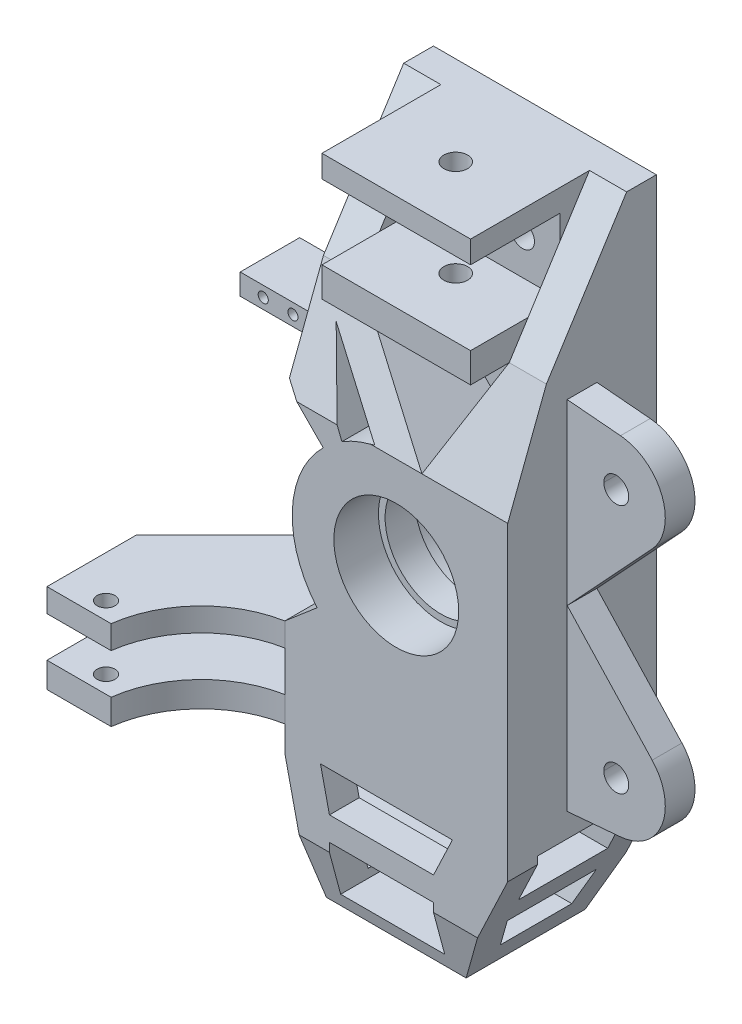
from build123d import *

# Parameters (mm, degrees)
SKETCH1_W                         = 75
SKETCH1_H                         = 50
BE_MAIN_UPRIGHT_BODY_DEPTH        = 221
SKETCH4_R                         = 18.75
CE_THROUGH_HOLE_DEPTH             = 230.667694724
SKETCH2_R                         = 21
CE_INNER_BEARING_DEPTH            = 15
SKETCH3_R                         = 23.5
CE_OUTER_BEARING_DEPTH            = 15
SKETCH7_W                         = 10
SKETCH7_H                         = 120
BE_CALIPER_MOUNT_DEPTH            = 33
SKETCH21_W                        = 30
SKETCH21_H                        = 7.080920813
BE_TEMP_SENSOR_MOUNT_V2_DEPTH     = 10
SKETCH9_W                         = 60
SKETCH9_H                         = 30
BE_TIE_ROD_MOUNT_DEPTH            = 50
SKETCH10_R                        = 4.2
CE_CALIPER_HOLES_DEPTH            = 243.893495178
SKETCH12_R                        = 4
CE_TOP_CLEVIS_HOLES_DEPTH         = 243.893495178
SKETCH33_W                        = 50
SKETCH33_H                        = 25
CE_SIMPLE_TOP_CLEVIS_SPACE_DEPTH  = 30
SKETCH34_R                        = 4
CUT_EXTRUDE12_DEPTH               = 42.5
SKETCH14_W                        = 25
SKETCH14_H                        = 12
CE_BOTTOM_CLEVIS_SPACE_DEPTH      = 243.893495178
SKETCH15_W                        = 25
SKETCH15_H                        = 5
CE_EXPAND_BOTTOM_CLEVIS_DEPTH     = 243.893495178
CE_WIDEN_BOTTOM_CLEVIS_DEPTH      = 240.74121548
CE_WIDEN_BOTTOM_CLEVIS_DEPTH_BACK = 240.74121548
SKETCH16_W                        = 10.007554032
SKETCH16_H                        = 17
CHAMFER1_SIZE                     = 30
SKETCH18_W                        = 14.04398123
SKETCH18_H                        = 13.562779604
CUT_EXTRUDE1_DEPTH                = 20
SKETCH19_R                        = 3
CUT_EXTRUDE2_DEPTH                = 177.032667423
SKETCH22_R                        = 1.7
CUT_EXTRUDE4_DEPTH                = 20
SKETCH31_R                        = 4
CUT_EXTRUDE9_DEPTH                = 31.5
SKETCH35_R                        = 21
CUT_EXTRUDE13_DEPTH               = 10
CUT_EXTRUDE14_REACH               = 244.893
CUT_EXTRUDE15_REACH               = 244.893
SKETCH38_W                        = 50
SKETCH38_H                        = 13.562779604
CUT_EXTRUDE16_DEPTH               = 251.793241536
CUT_EXTRUDE17_DEPTH               = 177.032667423
CUT_EXTRUDE18_DEPTH               = 30
CUT_EXTRUDE19_DEPTH               = 30
CUT_EXTRUDE20_REACH               = 244.893
CUT_EXTRUDE21_REACH               = 245.972
CUT_EXTRUDE21_DIRECTION_2_REACH   = 245.972
CUT_EXTRUDE22_REACH               = 245.972
CUT_EXTRUDE22_DIRECTION_2_REACH   = 245.972
CUT_EXTRUDE28_REACH               = 261.79
CUT_EXTRUDE31_START               = -25
CUT_EXTRUDE31_DEPTH               = 12.5
CUT_EXTRUDE32_START               = 25
CUT_EXTRUDE32_DEPTH               = 12.5
CUT_EXTRUDE33_START               = -37.5
SKETCH53_W                        = 30
SKETCH53_H                        = 15.915336889
CUT_EXTRUDE33_DEPTH               = 75
CUT_EXTRUDE34_REACH               = 244.893


with BuildPart() as part:
    # Sketch1 → BE - main upright body (new body)
    with BuildSketch(Plane(origin=(0, 0, 0), x_dir=(1, 0, 0), z_dir=(0, 1, 0))):
        Rectangle(SKETCH1_W, SKETCH1_H)
    extrude(amount=BE_MAIN_UPRIGHT_BODY_DEPTH)

    # Sketch4 → CE - Through hole (cut, through all)
    with BuildSketch(Plane.XY.offset(25)):
        with Locations((0, 110.5)):
            Circle(SKETCH4_R)
    extrude(amount=-CE_THROUGH_HOLE_DEPTH, mode=Mode.SUBTRACT)

    # Sketch2 → CE - Inner bearing (cut)
    with BuildSketch(Plane.XY.offset(25)):
        with Locations((0, 110.5)):
            Circle(SKETCH2_R)
    extrude(amount=-CE_INNER_BEARING_DEPTH, mode=Mode.SUBTRACT)

    # Sketch3 → CE - Outer bearing (cut)
    with BuildSketch(Plane(origin=(0, 0, -25), x_dir=(-1, 0, 0), z_dir=(0, 0, -1))):
        with Locations((0, 110.5)):
            Circle(SKETCH3_R)
    extrude(amount=-CE_OUTER_BEARING_DEPTH, mode=Mode.SUBTRACT)

    # Sketch7 → BE - caliper mount (add)
    with BuildSketch(Plane(origin=(37.5, 0, 0), x_dir=(0, 0, -1), z_dir=(1, 0, 0))):
        with Locations((0, 110.5)):
            Rectangle(SKETCH7_W, SKETCH7_H)
    extrude(amount=BE_CALIPER_MOUNT_DEPTH)

    # Sketch21 → BE - temp sensor mount v2 (add, symmetric)
    with BuildSketch(Plane.XY):
        with Locations((-52.5, 154.131183389)):
            Rectangle(SKETCH21_W, SKETCH21_H)
    extrude(amount=BE_TEMP_SENSOR_MOUNT_V2_DEPTH, both=True)

    # Sketch9 → BE - tie rod mount (add)
    with BuildSketch(Plane.ZY.offset(37.5)):
        with Locations((25, 63.5)):
            Rectangle(SKETCH9_W, SKETCH9_H)
    extrude(amount=BE_TIE_ROD_MOUNT_DEPTH)

    # Sketch10 → CE - caliper holes (cut, through all)
    with BuildSketch(Plane.XY.offset(5)):
        with Locations((54, 152.5)):
            Circle(SKETCH10_R)
        with Locations((54, 68.5)):
            Circle(SKETCH10_R)
    extrude(amount=-CE_CALIPER_HOLES_DEPTH, mode=Mode.SUBTRACT)

    # Sketch12 → CE - top clevis holes (cut, through all)
    with BuildSketch(Plane.XY.offset(25)):
        with Locations((-12.5, 201)):
            Circle(SKETCH12_R)
        with Locations((12.5, 201)):
            Circle(SKETCH12_R)
    extrude(amount=-CE_TOP_CLEVIS_HOLES_DEPTH, mode=Mode.SUBTRACT)

    # Sketch33 → CE - simple top clevis space (cut)
    with BuildSketch(Plane.XY.offset(25)):
        with Locations((0, 201)):
            Rectangle(SKETCH33_W, SKETCH33_H)
    extrude(amount=-CE_SIMPLE_TOP_CLEVIS_SPACE_DEPTH, mode=Mode.SUBTRACT)

    # Sketch34 → Cut-Extrude12 (cut)
    with BuildSketch(Plane(origin=(0, 221, 0), x_dir=(1, 0, 0), z_dir=(0, 1, 0))):
        with Locations(Location((0, -5, 0), (0, 0, 90))):
            Circle(SKETCH34_R)
    extrude(amount=-CUT_EXTRUDE12_DEPTH, mode=Mode.SUBTRACT)

    # Sketch14 → CE - bottom clevis space (cut, through all)
    with BuildSketch(Plane.XY.offset(25)):
        with Locations((-9.98, 10.5)):
            Rectangle(SKETCH14_W, SKETCH14_H)
    extrude(amount=-CE_BOTTOM_CLEVIS_SPACE_DEPTH, mode=Mode.SUBTRACT)

    # Sketch15 → CE - expand bottom clevis (cut, through all)
    with BuildSketch(Plane.XY.offset(25)):
        with Locations((-9.98, 19)):
            Rectangle(SKETCH15_W, SKETCH15_H)
    extrude(amount=-CE_EXPAND_BOTTOM_CLEVIS_DEPTH, mode=Mode.SUBTRACT)

    # Sketch16 → CE - widen bottom clevis (cut, two sides: drawn at the far end of the back side and taken through both)
    with BuildSketch(Plane(origin=(2.52, 4.5, 25), x_dir=(1, 0, 0), z_dir=(0, 0, 1)).offset(-CE_WIDEN_BOTTOM_CLEVIS_DEPTH_BACK)):
        with Locations((5.003777016, 8.5)):
            Rectangle(SKETCH16_W, SKETCH16_H)
    extrude(amount=CE_WIDEN_BOTTOM_CLEVIS_DEPTH + CE_WIDEN_BOTTOM_CLEVIS_DEPTH_BACK, mode=Mode.SUBTRACT)

    # Chamfer1
    chamfer1_edges = [part.edges().sort_by_distance(p)[0] for p in [
        (-87.5, 63.5, -5),
    ]]
    chamfer(chamfer1_edges, length=CHAMFER1_SIZE)

    # Sketch18 → Cut-Extrude1 (cut)
    with BuildSketch(Plane.XY.offset(55)):
        with Locations((-73.48, 63.84)):
            Rectangle(SKETCH18_W, SKETCH18_H)
    extrude(amount=-CUT_EXTRUDE1_DEPTH, mode=Mode.SUBTRACT)

    # Sketch19 → Cut-Extrude2 (cut, through all)
    with BuildSketch(Plane(origin=(0, 78.5, 0), x_dir=(1, 0, 0), z_dir=(0, 1, 0))):
        with Locations(Location((-73.48, -49.15, 0), (0, 0, 270))):
            Circle(SKETCH19_R)
    extrude(amount=-CUT_EXTRUDE2_DEPTH, mode=Mode.SUBTRACT)

    # Sketch22 → Cut-Extrude4 (cut)
    with BuildSketch(Plane.XY.offset(10)):
        with Locations((-59.752411208, 154.131183389)):
            Circle(SKETCH22_R)
        with Locations((-49.752411208, 154.131183389)):
            Circle(SKETCH22_R)
    extrude(amount=-CUT_EXTRUDE4_DEPTH, mode=Mode.SUBTRACT)

    # Sketch31 → Cut-Extrude9 (cut)
    with BuildSketch(Plane.XZ):
        with Locations(Location((-9.98, -1.65, 0), (0, 0, 90))):
            Circle(SKETCH31_R)
    extrude(amount=-CUT_EXTRUDE9_DEPTH, mode=Mode.SUBTRACT)

    # Sketch35 → Cut-Extrude13 (cut)
    with BuildSketch(Plane.XY):
        with Locations((0, 110.5)):
            Circle(SKETCH35_R)
    extrude(amount=-CUT_EXTRUDE13_DEPTH, mode=Mode.SUBTRACT)

    # Sketch36 → Cut-Extrude14 (cut, up to next)
    with BuildSketch(Plane.XY.offset(25), mode=Mode.PRIVATE) as cut_extrude14_sk1:
        with BuildLine():
            Line((-37.5, 78.5), (-37.5, 148.5))
            Line((-37.5, 148.5), (-24.584299319, 135.412089977))
            ThreePointArc((-24.584299319, 135.412089977), (-34.967951791, 111.997447011), (-26.624032587, 87.780825526))
            Line((-26.624032587, 87.780825526), (-37.5, 78.5))
        make_face()
    cut_extrude14_tool1 = extrude(cut_extrude14_sk1.sketch, amount=-CUT_EXTRUDE14_REACH, mode=Mode.PRIVATE) & part.part
    add(cut_extrude14_tool1.solids().sort_by_distance((-35.679116, 112.027901, 25))[0], mode=Mode.SUBTRACT)

    # Sketch37 → Cut-Extrude15 (cut, up to next)
    with BuildSketch(Plane.XY.offset(5), mode=Mode.PRIVATE) as cut_extrude15_sk1:
        with BuildLine():
            Line((70.5, 68.499999966), (70.5, 152.5))
            ThreePointArc((70.5, 152.5), (69.357399642, 146.466735855), (66.087845304, 141.269060773))
            Line((66.087845304, 141.269060773), (37.5, 110.5))
            Line((37.5, 110.5), (66.087845304, 79.730939227))
            ThreePointArc((66.087845304, 79.730939227), (69.357399648, 74.533264129), (70.5, 68.499999966))
        make_face()
    cut_extrude15_tool1 = extrude(cut_extrude15_sk1.sketch, amount=-CUT_EXTRUDE15_REACH, mode=Mode.PRIVATE) & part.part
    # Sketch37 → Cut-Extrude15 (cut, up to next)
    with BuildSketch(Plane.XY.offset(5), mode=Mode.PRIVATE) as cut_extrude15_sk2:
        with BuildLine():
            Line((37.5, 170.5), (55.432075472, 168.937735849))
            ThreePointArc((55.432075472, 168.937735849), (66.163043313, 163.649456371), (70.5, 152.5))
            Line((70.5, 152.5), (70.5, 170.5))
            Line((70.5, 170.5), (37.5, 170.5))
        make_face()
    cut_extrude15_tool2 = extrude(cut_extrude15_sk2.sketch, amount=-CUT_EXTRUDE15_REACH, mode=Mode.PRIVATE) & part.part
    # Sketch37 → Cut-Extrude15 (cut, up to next)
    with BuildSketch(Plane.XY.offset(5), mode=Mode.PRIVATE) as cut_extrude15_sk3:
        with BuildLine():
            Line((70.5, 50.5), (70.5, 68.499999966))
            ThreePointArc((70.5, 68.499999966), (66.163043302, 57.350543617), (55.432075472, 52.062264151))
            Line((55.432075472, 52.062264151), (37.5, 50.5))
            Line((37.5, 50.5), (70.5, 50.5))
        make_face()
    cut_extrude15_tool3 = extrude(cut_extrude15_sk3.sketch, amount=-CUT_EXTRUDE15_REACH, mode=Mode.PRIVATE) & part.part
    add(cut_extrude15_tool1.solids().sort_by_distance((59.586136, 110.5, 5))[0], mode=Mode.SUBTRACT)
    add(cut_extrude15_tool2.solids().sort_by_distance((63.343078, 167.056287, 5))[0], mode=Mode.SUBTRACT)
    add(cut_extrude15_tool3.solids().sort_by_distance((63.343078, 53.943713, 5))[0], mode=Mode.SUBTRACT)

    # Sketch38 → Cut-Extrude16 (cut, through all)
    with BuildSketch(Plane.XY.offset(55)):
        with Locations((-62.5, 63.84)):
            Rectangle(SKETCH38_W, SKETCH38_H)
    extrude(amount=-CUT_EXTRUDE16_DEPTH, mode=Mode.SUBTRACT)

    # Sketch40 → Cut-Extrude17 (cut, through all)
    with BuildSketch(Plane(origin=(0, 78.5, 0), x_dir=(1, 0, 0), z_dir=(0, 1, 0))):
        with BuildLine():
            Line((-37.5, -55), (-37.5, -25))
            ThreePointArc((-37.5, -25), (-56.610394877, -35.35784779), (-65.920500126, -55))
            Line((-65.920500126, -55), (-37.5, -55))
        make_face()
    extrude(amount=-CUT_EXTRUDE17_DEPTH, mode=Mode.SUBTRACT)

    # Sketch41 → Cut-Extrude18 (cut)
    with BuildSketch(Plane.XY.offset(25)):
        Polygon((-25, 178.5), (25, 178.5), (8.632949519, 144.418611154), align=None)
    extrude(amount=-CUT_EXTRUDE18_DEPTH, mode=Mode.SUBTRACT)

    # Sketch42 → Cut-Extrude19 (cut)
    with BuildSketch(Plane.XY.offset(25)):
        with BuildLine():
            Line((-28.5, 166.130603978), (-18.285214005, 140.343775713))
            ThreePointArc((-18.285214005, 140.343775713), (-13.011091277, 142.991714387), (-7.367050481, 144.715881798))
            Line((-7.367050481, 144.715881798), (-28.5, 166.130603978))
        make_face()
    extrude(amount=-CUT_EXTRUDE19_DEPTH, mode=Mode.SUBTRACT)

    # Sketch43 → Cut-Extrude20 (cut, up to next)
    with BuildSketch(Plane.XY.offset(25), mode=Mode.PRIVATE) as cut_extrude20_sk1:
        Polygon((18.527554032, 0), (37.5, 40), (37.5, 0), align=None)
    cut_extrude20_tool1 = extrude(cut_extrude20_sk1.sketch, amount=-CUT_EXTRUDE20_REACH, mode=Mode.PRIVATE) & part.part
    # Sketch43 → Cut-Extrude20 (cut, up to next)
    with BuildSketch(Plane.XY.offset(25), mode=Mode.PRIVATE) as cut_extrude20_sk2:
        Polygon((-28.48, 0), (-37.5, 40), (-37.5, 0), align=None)
    cut_extrude20_tool2 = extrude(cut_extrude20_sk2.sketch, amount=-CUT_EXTRUDE20_REACH, mode=Mode.PRIVATE) & part.part
    add(cut_extrude20_tool1.solids().sort_by_distance((31.175851, 13.333333, 25))[0], mode=Mode.SUBTRACT)
    add(cut_extrude20_tool2.solids().sort_by_distance((-34.493333, 13.333333, 25))[0], mode=Mode.SUBTRACT)

    # Sketch44 → Cut-Extrude21 (cut, up to next)
    with BuildSketch(Plane(origin=(0, 0, 0), x_dir=(0, 0, -1), z_dir=(1, 0, 0)), mode=Mode.PRIVATE) as cut_extrude21_sk1:
        Polygon((-15, 18.584663111), (15, 18.584663111), (12.007188059, 7.415336889), (-12.007188059, 7.415336889), align=None)
    cut_extrude21_tool1 = extrude(cut_extrude21_sk1.sketch, amount=-CUT_EXTRUDE21_REACH, mode=Mode.PRIVATE) & part.part
    add(cut_extrude21_tool1.solids().sort_by_distance((0, 13.206289, 0))[0], mode=Mode.SUBTRACT)

    # Sketch44 → Cut-Extrude21 direction 2 (cut, up to next)
    with BuildSketch(Plane(origin=(0, 0, 0), x_dir=(0, 0, -1), z_dir=(1, 0, 0)), mode=Mode.PRIVATE) as cut_extrude21_direction_2_sk1:
        Polygon((-15, 18.584663111), (15, 18.584663111), (12.007188059, 7.415336889), (-12.007188059, 7.415336889), align=None)
    cut_extrude21_direction_2_tool1 = extrude(cut_extrude21_direction_2_sk1.sketch, amount=CUT_EXTRUDE21_DIRECTION_2_REACH, mode=Mode.PRIVATE) & part.part
    add(cut_extrude21_direction_2_tool1.solids().sort_by_distance((0, 13.206289, 0))[0], mode=Mode.SUBTRACT)

    # Sketch45 → Cut-Extrude22 (cut, up to next)
    with BuildSketch(Plane(origin=(0, 0, 0), x_dir=(0, 0, -1), z_dir=(1, 0, 0)), mode=Mode.PRIVATE) as cut_extrude22_sk1:
        Polygon((-25, 18.584663111), (-20.020254528, 0), (-25, 0), align=None)
    cut_extrude22_tool1 = extrude(cut_extrude22_sk1.sketch, amount=-CUT_EXTRUDE22_REACH, mode=Mode.PRIVATE) & part.part
    # Sketch45 → Cut-Extrude22 (cut, up to next)
    with BuildSketch(Plane(origin=(0, 0, 0), x_dir=(0, 0, -1), z_dir=(1, 0, 0)), mode=Mode.PRIVATE) as cut_extrude22_sk2:
        Polygon((25, 0), (25, 18.584663111), (20.020254528, 0), align=None)
    cut_extrude22_tool2 = extrude(cut_extrude22_sk2.sketch, amount=-CUT_EXTRUDE22_REACH, mode=Mode.PRIVATE) & part.part
    add(cut_extrude22_tool1.solids().sort_by_distance((0, 6.194888, 23.340085))[0], mode=Mode.SUBTRACT)
    add(cut_extrude22_tool2.solids().sort_by_distance((0, 6.194888, -23.340085))[0], mode=Mode.SUBTRACT)

    # Sketch45 → Cut-Extrude22 direction 2 (cut, up to next)
    with BuildSketch(Plane(origin=(0, 0, 0), x_dir=(0, 0, -1), z_dir=(1, 0, 0)), mode=Mode.PRIVATE) as cut_extrude22_direction_2_sk1:
        Polygon((-25, 18.584663111), (-20.020254528, 0), (-25, 0), align=None)
    cut_extrude22_direction_2_tool1 = extrude(cut_extrude22_direction_2_sk1.sketch, amount=CUT_EXTRUDE22_DIRECTION_2_REACH, mode=Mode.PRIVATE) & part.part
    # Sketch45 → Cut-Extrude22 direction 2 (cut, up to next)
    with BuildSketch(Plane(origin=(0, 0, 0), x_dir=(0, 0, -1), z_dir=(1, 0, 0)), mode=Mode.PRIVATE) as cut_extrude22_direction_2_sk2:
        Polygon((25, 0), (25, 18.584663111), (20.020254528, 0), align=None)
    cut_extrude22_direction_2_tool2 = extrude(cut_extrude22_direction_2_sk2.sketch, amount=CUT_EXTRUDE22_DIRECTION_2_REACH, mode=Mode.PRIVATE) & part.part
    add(cut_extrude22_direction_2_tool1.solids().sort_by_distance((0, 6.194888, 23.340085))[0], mode=Mode.SUBTRACT)
    add(cut_extrude22_direction_2_tool2.solids().sort_by_distance((0, 6.194888, -23.340085))[0], mode=Mode.SUBTRACT)

    # Cut-Extrude28: up to this face of the body (flat: up to its plane)
    cut_extrude28_end = Plane(part.part.faces().sort_by_distance((-37.5, 185.994821508, 0))[0])
    # Sketch48 → Cut-Extrude28 (cut, up to the picked face)
    with BuildSketch(Plane(origin=(37.5, 0, 0), x_dir=(0, 0, -1), z_dir=(1, 0, 0)), mode=Mode.PRIVATE) as cut_extrude28_sk1:
        Polygon((-12, 178.5), (-25, 178.5), (-25, 144.418611154), align=None)
    cut_extrude28_tool1 = split(extrude(cut_extrude28_sk1.sketch, amount=-CUT_EXTRUDE28_REACH, mode=Mode.PRIVATE), bisect_by=cut_extrude28_end, keep=Keep.BOTH, mode=Mode.PRIVATE)
    add(cut_extrude28_tool1.solids().sort_by(Axis((37.5, 167.139537, 20.666667), (-1, 0, 0)))[0], mode=Mode.SUBTRACT)

    # Sketch51 → Cut-Extrude31 (cut)
    with BuildSketch(Plane(origin=(0, 0, 0), x_dir=(0, 0, -1), z_dir=(1, 0, 0)).offset(CUT_EXTRUDE31_START)):
        Polygon((-12, 178.5), (-25, 178.5), (-25, 221), (15, 221), align=None)
    extrude(amount=-CUT_EXTRUDE31_DEPTH, mode=Mode.SUBTRACT)

    # Sketch51<2> → Cut-Extrude32 (cut)
    with BuildSketch(Plane(origin=(0, 0, 0), x_dir=(0, 0, -1), z_dir=(1, 0, 0)).offset(CUT_EXTRUDE32_START)):
        Polygon((-12, 178.5), (-25, 178.5), (-25, 221), (15, 221), align=None)
    extrude(amount=CUT_EXTRUDE32_DEPTH, mode=Mode.SUBTRACT)

    # Sketch53 → Cut-Extrude33 (cut)
    with BuildSketch(Plane(origin=(0, 0, 0), x_dir=(0, 0, -1), z_dir=(1, 0, 0)).offset(CUT_EXTRUDE33_START)):
        with Locations((0, 34.542331555)):
            Rectangle(SKETCH53_W, SKETCH53_H)
    extrude(amount=CUT_EXTRUDE33_DEPTH, mode=Mode.SUBTRACT)

    # Sketch54 → Cut-Extrude34 (cut, up to next)
    with BuildSketch(Plane.XY.offset(25), mode=Mode.PRIVATE) as cut_extrude34_sk1:
        Polygon((-22.48, 29.5), (12.527554032, 29.5), (18.879747693, 42.892461197), (-25.5, 42.892461197), align=None)
    cut_extrude34_tool1 = extrude(cut_extrude34_sk1.sketch, amount=-CUT_EXTRUDE34_REACH, mode=Mode.PRIVATE) & part.part
    add(cut_extrude34_tool1.solids().sort_by_distance((-4.110392, 36.459742, 25))[0], mode=Mode.SUBTRACT)


solid = part.part
